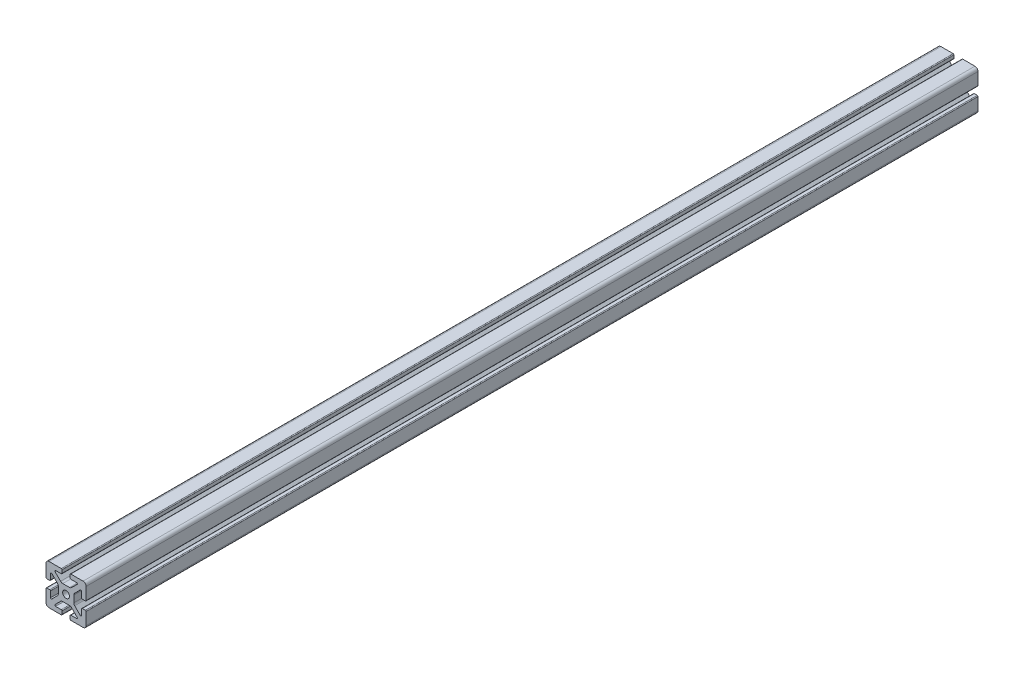
from build123d import *

# Parameters (mm, degrees)
SKETCH1_R      = 3.4036
EXTRUDE1_DEPTH = 444.5


with BuildPart() as part:
    # Sketch1 → Extrude1 (new, symmetric)
    with BuildSketch(Plane.XY):
        with BuildLine():
            Line((-20, 16.952), (-20, 4.7625))
            ThreePointArc((-20, 4.7625), (-19.776815367, 4.223684633), (-19.238, 4.0005))
            Line((-19.238, 4.0005), (-16.2662, 4.0005))
            ThreePointArc((-16.2662, 4.0005), (-15.727384633, 4.223684633), (-15.5042, 4.7625))
            Line((-15.5042, 4.7625), (-15.5042, 10.485558599))
            ThreePointArc((-15.5042, 10.485558599), (-15.033804775, 11.189554802), (-14.203384633, 11.024373966))
            Line((-14.203384633, 11.024373966), (-8.635059555, 5.456048889))
            ThreePointArc((-8.635059555, 5.456048889), (-7.985348265, 4.483687227), (-7.7572, 3.336708444))
            Line((-7.7572, 3.336708444), (-7.7572, -3.336708444))
            ThreePointArc((-7.7572, -3.336708444), (-7.985348265, -4.483687227), (-8.635059555, -5.456048889))
            Line((-8.635059555, -5.456048889), (-14.203384633, -11.024373966))
            ThreePointArc((-14.203384633, -11.024373966), (-15.033804775, -11.189554802), (-15.5042, -10.485558599))
            Line((-15.5042, -10.485558599), (-15.5042, -4.7625))
            ThreePointArc((-15.5042, -4.7625), (-15.727384633, -4.223684633), (-16.2662, -4.0005))
            Line((-16.2662, -4.0005), (-19.238, -4.0005))
            ThreePointArc((-19.238, -4.0005), (-19.776815367, -4.223684633), (-20, -4.7625))
            Line((-20, -4.7625), (-20, -16.952))
            ThreePointArc((-20, -16.952), (-19.107261469, -19.107261469), (-16.952, -20))
            Line((-16.952, -20), (-4.7625, -20))
            ThreePointArc((-4.7625, -20), (-4.223684633, -19.776815367), (-4.0005, -19.238))
            Line((-4.0005, -19.238), (-4.0005, -16.2662))
            ThreePointArc((-4.0005, -16.2662), (-4.223684633, -15.727384633), (-4.7625, -15.5042))
            Line((-4.7625, -15.5042), (-10.485558599, -15.5042))
            ThreePointArc((-10.485558599, -15.5042), (-11.189554802, -15.033804775), (-11.024373966, -14.203384633))
            Line((-11.024373966, -14.203384633), (-5.456048889, -8.635059555))
            ThreePointArc((-5.456048889, -8.635059555), (-4.483687227, -7.985348265), (-3.336708444, -7.7572))
            Line((-3.336708444, -7.7572), (3.336708444, -7.7572))
            ThreePointArc((3.336708444, -7.7572), (4.483687227, -7.985348265), (5.456048889, -8.635059555))
            Line((5.456048889, -8.635059555), (11.024373966, -14.203384633))
            ThreePointArc((11.024373966, -14.203384633), (11.189554802, -15.033804775), (10.485558599, -15.5042))
            Line((10.485558599, -15.5042), (4.7625, -15.5042))
            ThreePointArc((4.7625, -15.5042), (4.223684633, -15.727384633), (4.0005, -16.2662))
            Line((4.0005, -16.2662), (4.0005, -19.238))
            ThreePointArc((4.0005, -19.238), (4.223684633, -19.776815367), (4.7625, -20))
            Line((4.7625, -20), (16.952, -20))
            ThreePointArc((16.952, -20), (19.107261469, -19.107261469), (20, -16.952))
            Line((20, -16.952), (20, -4.7625))
            ThreePointArc((20, -4.7625), (19.776815367, -4.223684633), (19.238, -4.0005))
            Line((19.238, -4.0005), (16.2662, -4.0005))
            ThreePointArc((16.2662, -4.0005), (15.727384633, -4.223684633), (15.5042, -4.7625))
            Line((15.5042, -4.7625), (15.5042, -10.485558599))
            ThreePointArc((15.5042, -10.485558599), (15.033804775, -11.189554802), (14.203384633, -11.024373966))
            Line((14.203384633, -11.024373966), (8.635059555, -5.456048889))
            ThreePointArc((8.635059555, -5.456048889), (7.985348265, -4.483687227), (7.7572, -3.336708444))
            Line((7.7572, -3.336708444), (7.7572, 3.336708444))
            ThreePointArc((7.7572, 3.336708444), (7.985348265, 4.483687227), (8.635059555, 5.456048889))
            Line((8.635059555, 5.456048889), (14.203384633, 11.024373966))
            ThreePointArc((14.203384633, 11.024373966), (15.033804775, 11.189554802), (15.5042, 10.485558599))
            Line((15.5042, 10.485558599), (15.5042, 4.7625))
            ThreePointArc((15.5042, 4.7625), (15.727384633, 4.223684633), (16.2662, 4.0005))
            Line((16.2662, 4.0005), (19.238, 4.0005))
            ThreePointArc((19.238, 4.0005), (19.776815367, 4.223684633), (20, 4.7625))
            Line((20, 4.7625), (20, 16.952))
            ThreePointArc((20, 16.952), (19.107261469, 19.107261469), (16.952, 20))
            Line((16.952, 20), (4.7625, 20))
            ThreePointArc((4.7625, 20), (4.223684633, 19.776815367), (4.0005, 19.238))
            Line((4.0005, 19.238), (4.0005, 16.2662))
            ThreePointArc((4.0005, 16.2662), (4.223684633, 15.727384633), (4.7625, 15.5042))
            Line((4.7625, 15.5042), (10.485558599, 15.5042))
            ThreePointArc((10.485558599, 15.5042), (11.189554802, 15.033804775), (11.024373966, 14.203384633))
            Line((11.024373966, 14.203384633), (5.456048889, 8.635059555))
            ThreePointArc((5.456048889, 8.635059555), (4.483687227, 7.985348265), (3.336708444, 7.7572))
            Line((3.336708444, 7.7572), (-3.336708444, 7.7572))
            ThreePointArc((-3.336708444, 7.7572), (-4.483687227, 7.985348265), (-5.456048889, 8.635059555))
            Line((-5.456048889, 8.635059555), (-11.024373966, 14.203384633))
            ThreePointArc((-11.024373966, 14.203384633), (-11.189554802, 15.033804775), (-10.485558599, 15.5042))
            Line((-10.485558599, 15.5042), (-4.7625, 15.5042))
            ThreePointArc((-4.7625, 15.5042), (-4.223684633, 15.727384633), (-4.0005, 16.2662))
            Line((-4.0005, 16.2662), (-4.0005, 19.238))
            ThreePointArc((-4.0005, 19.238), (-4.223684633, 19.776815367), (-4.7625, 20))
            Line((-4.7625, 20), (-16.952, 20))
            ThreePointArc((-16.952, 20), (-19.107261469, 19.107261469), (-20, 16.952))
        make_face()
        Circle(SKETCH1_R, mode=Mode.SUBTRACT)
    extrude(amount=EXTRUDE1_DEPTH, both=True)


solid = part.part
